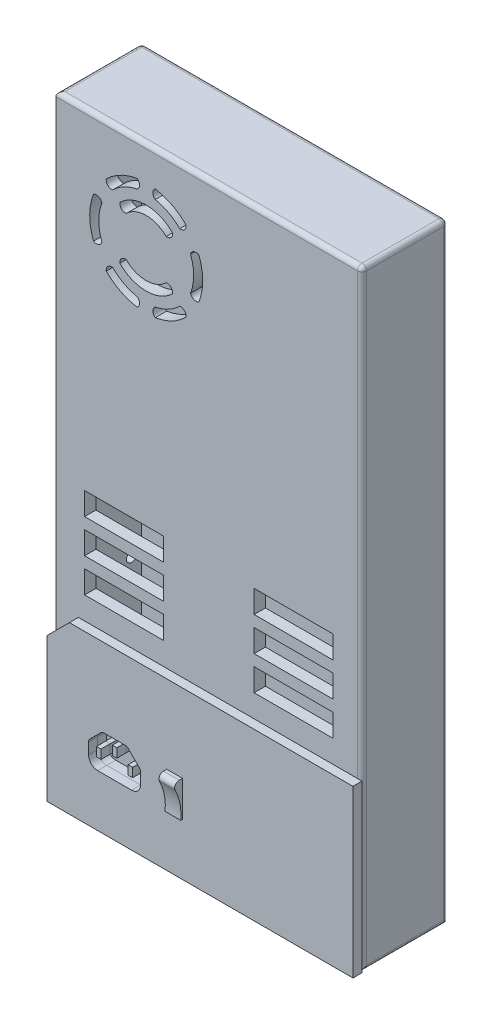
from build123d import *

# Parameters (mm, degrees)
SKETCH1_W           = 135.5
SKETCH1_H           = 38
BOSS_EXTRUDE1_DEPTH = 270
BOSS_EXTRUDE2_DEPTH = 4
SHELL2_T            = -5
SKETCH4_W           = 125.5
SKETCH4_H           = 28
BOSS_EXTRUDE3_DEPTH = 5
CUT_EXTRUDE1_DEPTH  = 5
CUT_EXTRUDE2_DEPTH  = 5
SKETCH7_W           = 35
SKETCH7_H           = 10
CUT_EXTRUDE3_DEPTH  = 5
FILLET1_R           = 2
SKETCH8_W           = 2
SKETCH8_H           = 4
CUT_EXTRUDE4_DEPTH  = 8
SKETCH9_W           = 6.95582013
SKETCH9_H           = 15.8
BOSS_EXTRUDE5_DEPTH = 5
SKETCH11_R          = 2.25
CUT_EXTRUDE6_DEPTH  = 5
CUT_EXTRUDE7_DEPTH  = 282.742345704
FILLET2_R           = 2


with BuildPart() as part:
    # Sketch1 → Boss-Extrude1 (new body)
    with BuildSketch(Plane(origin=(0, 0, 0), x_dir=(1, 0, 0), z_dir=(0, 1, 0))):
        Rectangle(SKETCH1_W, SKETCH1_H)
    extrude(amount=BOSS_EXTRUDE1_DEPTH)

    # Shell2
    shell2_openings = [part.faces().sort_by_distance(p)[0] for p in [
        (0, 0, 0),
    ]]
    offset(amount=SHELL2_T, openings=shell2_openings, kind=Kind.INTERSECTION)

    # Sketch4 → Boss-Extrude3 (add)
    with BuildSketch(Plane.XZ):
        Rectangle(SKETCH4_W, SKETCH4_H)
    extrude(amount=-BOSS_EXTRUDE3_DEPTH)

    # Sketch5 → Cut-Extrude1 (cut)
    with BuildSketch(Plane.XY.offset(19)):
        with BuildLine():
            ThreePointArc((-51.073807579, 239), (-52.75, 230), (-51.073807579, 221))
            ThreePointArc((-51.073807579, 221), (-48.844330346, 220.822571892), (-47.365045246, 222.5))
            ThreePointArc((-47.365045246, 222.5), (-48.75, 230), (-47.365045246, 237.5))
            ThreePointArc((-47.365045246, 237.5), (-48.844330346, 239.177428108), (-51.073807579, 239))
        make_face()
        with BuildLine():
            ThreePointArc((-45.42766953, 247.67766953), (-44.720562748, 245.556349186), (-42.599242405, 244.849242405))
            ThreePointArc((-42.599242405, 244.849242405), (-37.605759614, 248.54357038), (-31.75, 250.615528128))
            ThreePointArc((-31.75, 250.615528128), (-30.707474592, 252.646726743), (-31.75, 254.677925359))
            ThreePointArc((-31.75, 254.677925359), (-39.139962005, 252.254634698), (-45.42766953, 247.67766953))
        make_face()
        with BuildLine():
            ThreePointArc((-10.07233047, 247.67766953), (-10.779437252, 245.556349186), (-12.900757595, 244.849242405))
            ThreePointArc((-12.900757595, 244.849242405), (-17.894240386, 248.54357038), (-23.75, 250.615528128))
            ThreePointArc((-23.75, 250.615528128), (-24.792525408, 252.646726743), (-23.75, 254.677925359))
            ThreePointArc((-23.75, 254.677925359), (-16.360037995, 252.254634698), (-10.07233047, 247.67766953))
        make_face()
        with BuildLine():
            ThreePointArc((-45.42766953, 212.32233047), (-44.720562748, 214.443650814), (-42.599242405, 215.150757595))
            ThreePointArc((-42.599242405, 215.150757595), (-37.605759614, 211.45642962), (-31.75, 209.384471872))
            ThreePointArc((-31.75, 209.384471872), (-30.707474592, 207.353273257), (-31.75, 205.322074641))
            ThreePointArc((-31.75, 205.322074641), (-39.139962005, 207.745365302), (-45.42766953, 212.32233047))
        make_face()
        with BuildLine():
            ThreePointArc((-10.07233047, 212.32233047), (-10.779437252, 214.443650814), (-12.900757595, 215.150757595))
            ThreePointArc((-12.900757595, 215.150757595), (-17.894240386, 211.45642962), (-23.75, 209.384471872))
            ThreePointArc((-23.75, 209.384471872), (-24.792525408, 207.353273257), (-23.75, 205.322074641))
            ThreePointArc((-23.75, 205.322074641), (-16.360037995, 207.745365302), (-10.07233047, 212.32233047))
        make_face()
        with BuildLine():
            ThreePointArc((-4.426192421, 221), (-6.655669654, 220.822571892), (-8.134954754, 222.5))
            ThreePointArc((-8.134954754, 222.5), (-6.75, 230), (-8.134954754, 237.5))
            ThreePointArc((-8.134954754, 237.5), (-6.655669654, 239.177428108), (-4.426192421, 239))
            ThreePointArc((-4.426192421, 239), (-2.75, 230), (-4.426192421, 221))
        make_face()
    extrude(amount=-CUT_EXTRUDE1_DEPTH, mode=Mode.SUBTRACT)

    # Sketch6 → Cut-Extrude2 (cut)
    with BuildSketch(Plane.XY.offset(19)):
        with BuildLine():
            ThreePointArc((-36.588834765, 221.161165235), (-27.75, 217.5), (-18.911165235, 221.161165235))
            ThreePointArc((-18.911165235, 221.161165235), (-16.789844892, 220.454058454), (-16.08273811, 218.33273811))
            ThreePointArc((-16.08273811, 218.33273811), (-27.75, 213.5), (-39.41726189, 218.33273811))
            ThreePointArc((-39.41726189, 218.33273811), (-38.710155108, 220.454058454), (-36.588834765, 221.161165235))
        make_face()
        with BuildLine():
            ThreePointArc((-16.08273811, 241.66726189), (-16.789844892, 239.545941546), (-18.911165235, 238.838834765))
            ThreePointArc((-18.911165235, 238.838834765), (-27.75, 242.5), (-36.588834765, 238.838834765))
            ThreePointArc((-36.588834765, 238.838834765), (-38.710155108, 239.545941546), (-39.41726189, 241.66726189))
            ThreePointArc((-39.41726189, 241.66726189), (-27.75, 246.5), (-16.08273811, 241.66726189))
        make_face()
    extrude(amount=-CUT_EXTRUDE2_DEPTH, mode=Mode.SUBTRACT)

    # Sketch7 → Cut-Extrude3 (cut)
    with BuildSketch(Plane.XY.offset(19)):
        with Locations((37.5, 88.449332994)):
            Rectangle(SKETCH7_W, SKETCH7_H)
        with Locations((-37.5, 88.449332994)):
            Rectangle(SKETCH7_W, SKETCH7_H)
        with Locations((-37.5, 103.449332994)):
            Rectangle(SKETCH7_W, SKETCH7_H)
        with Locations((37.5, 103.449332994)):
            Rectangle(SKETCH7_W, SKETCH7_H)
        with Locations((-37.5, 118.449332994)):
            Rectangle(SKETCH7_W, SKETCH7_H)
        with Locations((37.5, 118.449332994)):
            Rectangle(SKETCH7_W, SKETCH7_H)
    extrude(amount=-CUT_EXTRUDE3_DEPTH, mode=Mode.SUBTRACT)

    # Fillet1
    fillet1_edges = [part.edges().sort_by_distance(p)[0] for p in [
        (-67.75, 270, 0),
        (62.75, 135, 14),
        (0, 270, 19),
        (67.75, 270, 0),
        (67.75, 0, 0),
        (67.75, 135, 19),
        (-67.75, 135, -19),
        (67.75, 135, -19),
        (0, 270, -19),
    ]]
    fillet(fillet1_edges, radius=FILLET1_R)


with BuildPart() as body_2:
    # Sketch3 → Boss-Extrude2 (new body)
    with BuildSketch(Plane.XY.offset(19)):
        Polygon((-67.75, 0), (67.75, 0), (67.75, 73.449332994), (-57.75, 73.449332994), (-67.75, 63.449332994), align=None)
    extrude(amount=BOSS_EXTRUDE2_DEPTH)


with BuildPart() as cut_extrude4_tool:
    # Sketch8 → Cut-Extrude4 (new body)
    with BuildSketch(Plane.XY.offset(23)):
        with BuildLine():
            Line((-45.25, 23), (-30.25, 23))
            ThreePointArc((-30.25, 23), (-27.421572875, 24.171572875), (-26.25, 27))
            Line((-26.25, 27), (-26.25, 31.971572875))
            ThreePointArc((-26.25, 31.971572875), (-26.402240935, 32.73693974), (-26.835786438, 33.385786438))
            Line((-26.835786438, 33.385786438), (-31.664213562, 38.214213562))
            ThreePointArc((-31.664213562, 38.214213562), (-32.31306026, 38.647759065), (-33.078427125, 38.8))
            Line((-33.078427125, 38.8), (-42.421572875, 38.8))
            ThreePointArc((-42.421572875, 38.8), (-43.18693974, 38.647759065), (-43.835786438, 38.214213562))
            Line((-43.835786438, 38.214213562), (-48.664213562, 33.385786438))
            ThreePointArc((-48.664213562, 33.385786438), (-49.097759065, 32.73693974), (-49.25, 31.971572875))
            Line((-49.25, 31.971572875), (-49.25, 27))
            ThreePointArc((-49.25, 27), (-48.078427125, 24.171572875), (-45.25, 23))
        make_face()
        with Locations((-37.75, 34)):
            Rectangle(SKETCH8_W, SKETCH8_H, mode=Mode.SUBTRACT)
        with Locations((-44.75, 30)):
            Rectangle(SKETCH8_W, SKETCH8_H, mode=Mode.SUBTRACT)
        with Locations((-30.75, 30)):
            Rectangle(SKETCH8_W, SKETCH8_H, mode=Mode.SUBTRACT)
    extrude(amount=-CUT_EXTRUDE4_DEPTH)


with BuildPart() as part_1:
    add(part.part)

    # Cut-Extrude4: cut by cut_extrude4_tool
    add(cut_extrude4_tool.part, mode=Mode.SUBTRACT)

    # Sketch11 → Cut-Extrude6 (cut)
    with BuildSketch(Plane.ZY.offset(67.75)):
        with Locations((-9.5, 230)):
            Circle(SKETCH11_R)
        with Locations((-9.5, 80)):
            Circle(SKETCH11_R)
    extrude(amount=-CUT_EXTRUDE6_DEPTH, mode=Mode.SUBTRACT)


with BuildPart() as body_2_1:
    add(body_2.part)

    # Cut-Extrude4: cut by cut_extrude4_tool
    add(cut_extrude4_tool.part, mode=Mode.SUBTRACT)


with BuildPart() as body_3:
    # Sketch9 → Boss-Extrude5 (new body)
    with BuildSketch(Plane.XY.offset(23)):
        with Locations((-11.191473213, 30.9)):
            Rectangle(SKETCH9_W, SKETCH9_H)
    extrude(amount=BOSS_EXTRUDE5_DEPTH)

    # Sketch10 → Cut-Extrude7 (cut, through all)
    with BuildSketch(Plane(origin=(-7.713563148, 0, 0), x_dir=(0, 0, -1), z_dir=(1, 0, 0))):
        with BuildLine():
            Line((-28, 38.8), (-28, 23))
            Line((-28, 23), (-23.7, 23))
            ThreePointArc((-23.7, 23), (-24.46083461, 31.278063998), (-28, 38.8))
        make_face()
    extrude(amount=-CUT_EXTRUDE7_DEPTH, mode=Mode.SUBTRACT)

    # Fillet2
    fillet2_edges = [body_3.edges().sort_by_distance(p)[0] for p in [
        (-11.191473213, 38.8, 28),
    ]]
    fillet(fillet2_edges, radius=FILLET2_R)


solid = Compound([part_1.part, body_2_1.part, body_3.part])
